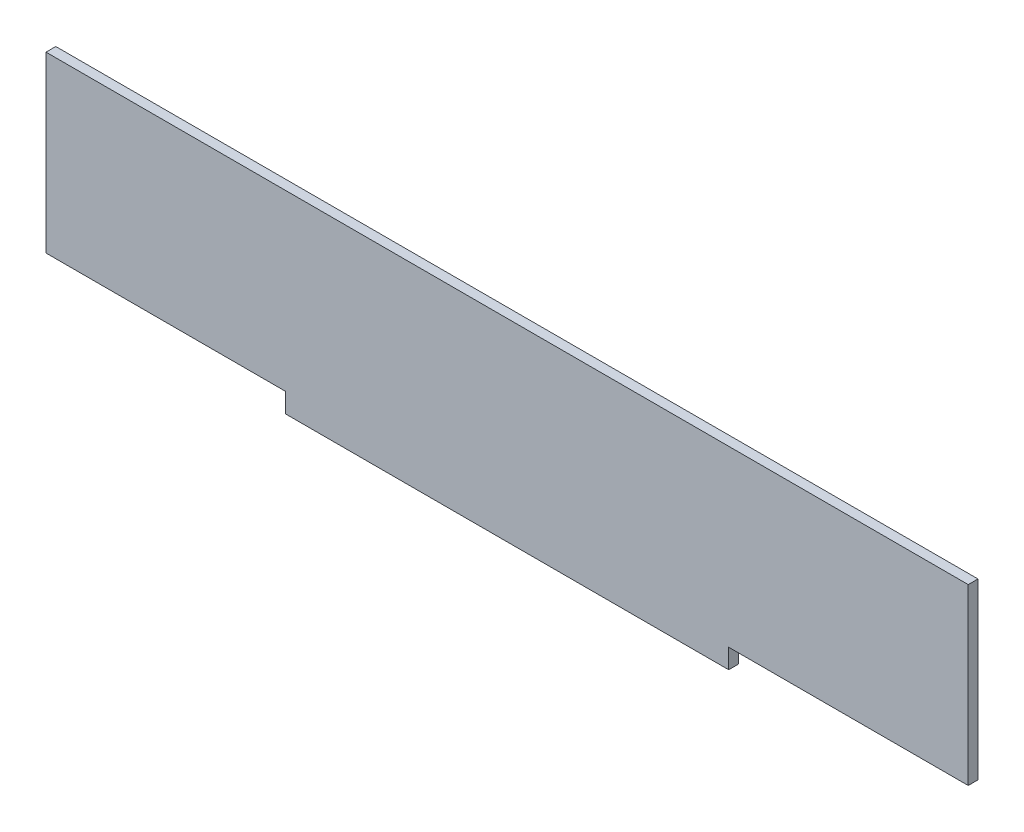
from build123d import *

# Parameters (mm, degrees)
SKETCH1_W           = 299.7
SKETCH1_H           = 56.55
BOSS_EXTRUDE1_DEPTH = 3.175
SKETCH2_W           = 144
SKETCH2_H           = 3.175
BOSS_EXTRUDE2_DEPTH = 6.35


with BuildPart() as part:
    # Sketch1 → Boss-Extrude1 (new body)
    with BuildSketch(Plane.XY):
        Rectangle(SKETCH1_W, SKETCH1_H)
    extrude(amount=BOSS_EXTRUDE1_DEPTH)

    # Sketch2 → Boss-Extrude2 (add)
    with BuildSketch(Plane.XZ.offset(28.275)):
        with Locations((0, 1.5875)):
            Rectangle(SKETCH2_W, SKETCH2_H)
    extrude(amount=BOSS_EXTRUDE2_DEPTH)


solid = part.part
